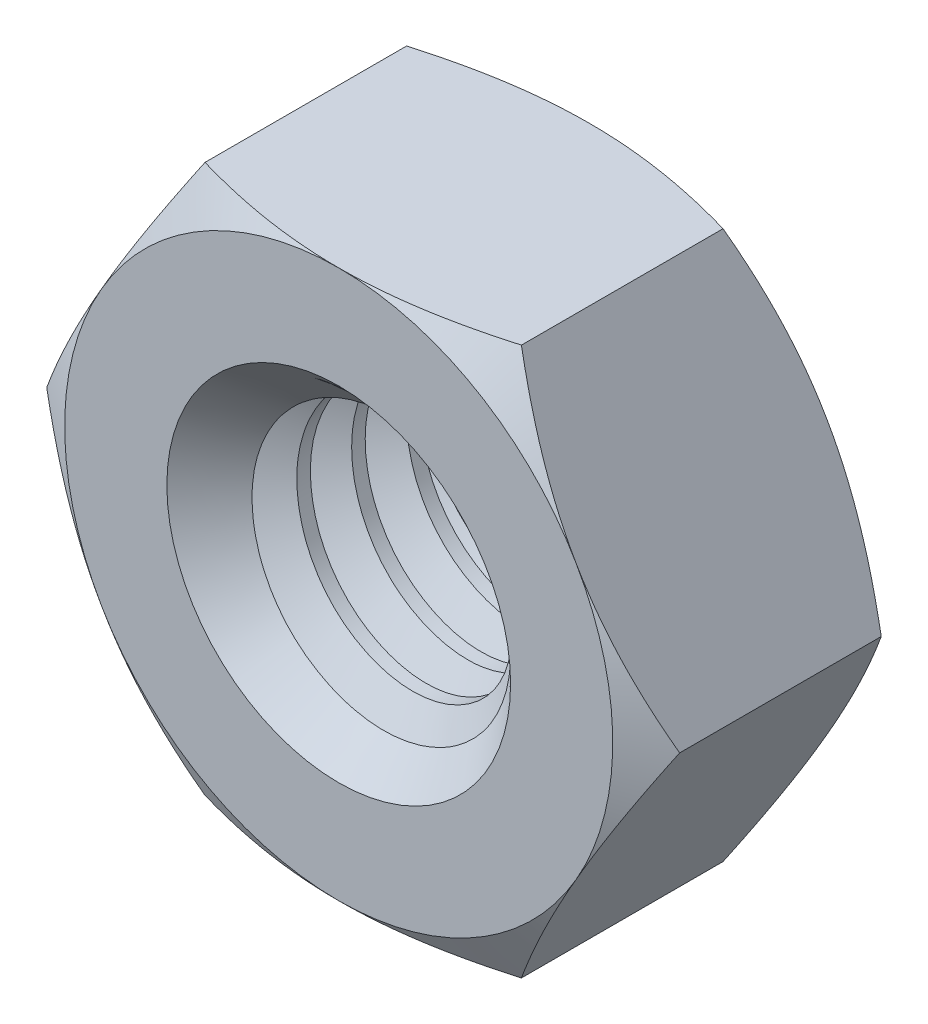
from build123d import *

# Parameters (mm, degrees)
Y_KSEKLIK_EKSTR_ZYON1_DEPTH = 3.2
IZIM2_OUTSIDE_W             = 23.4
IZIM2_OUTSIDE_H             = 22.318
IZIM2_OUTSIDE_R             = 3.5
KES_EKSTR_ZYON1_DEPTH       = 3.2
KES_EKSTR_ZYON1_DRAFT       = -60
IZIM3_OUTSIDE_W             = 23.4
IZIM3_OUTSIDE_H             = 22.318
IZIM3_OUTSIDE_R             = 3.5
KES_EKSTR_ZYON2_DEPTH       = 3.2
KES_EKSTR_ZYON2_DRAFT       = -60
IZIM5_R                     = 1.545
KES_EKSTR_ZYON3_DEPTH       = 3.2
PAH1_SIZE                   = 0.65
KES_S_P_R1_PITCH            = 0.7
KES_S_P_R1_HEIGHT           = 4
KES_S_P_R1_RADIUS           = 1.545


with BuildPart() as part:
    # Çizim1 → Yükseklik-Ekstrüzyon1 (new body)
    with BuildSketch(Plane.XY):
        Polygon((4.041451884, 0), (2.020725942, 3.5), (-2.020725942, 3.5), (-4.041451884, 0), (-2.020725942, -3.5), (2.020725942, -3.5), align=None)
    extrude(amount=Y_KSEKLIK_EKSTR_ZYON1_DEPTH)


with BuildPart() as kes_ekstr_zyon1_tool:
    # Çizim2 outside → Kes-Ekstrüzyon1 (with draft: the straight prism first)
    with BuildSketch(Plane.XY.offset(3.2)):
        Rectangle(IZIM2_OUTSIDE_W, IZIM2_OUTSIDE_H)
        Circle(IZIM2_OUTSIDE_R, mode=Mode.SUBTRACT)
    extrude(amount=-KES_EKSTR_ZYON1_DEPTH)
    # Kes-Ekstrüzyon1: the draft: its side faces are tilted about the plane it starts from
    kes_ekstr_zyon1_sides = [kes_ekstr_zyon1_tool.faces().sort_by_distance(p)[0] for p in [
        (0, -11.159, 1.6),
        (11.7, 0, 1.6),
        (0, 11.159, 1.6),
        (-11.7, 0, 1.6),
        (-3.5, 0, 1.6),
    ]]
    draft(kes_ekstr_zyon1_sides, Plane.XY.offset(3.2), KES_EKSTR_ZYON1_DRAFT)


with BuildPart() as part_1:
    add(part.part)

    # Kes-Ekstrüzyon1: cut by kes_ekstr_zyon1_tool
    add(kes_ekstr_zyon1_tool.part, mode=Mode.SUBTRACT)


with BuildPart() as kes_ekstr_zyon2_tool:
    # Çizim3 outside → Kes-Ekstrüzyon2 (with draft: the straight prism first)
    with BuildSketch(Plane(origin=(0, 0, 0), x_dir=(-1, 0, 0), z_dir=(0, 0, -1))):
        Rectangle(IZIM3_OUTSIDE_W, IZIM3_OUTSIDE_H)
        Circle(IZIM3_OUTSIDE_R, mode=Mode.SUBTRACT)
    extrude(amount=-KES_EKSTR_ZYON2_DEPTH)
    # Kes-Ekstrüzyon2: the draft: its side faces are tilted about the plane it starts from
    kes_ekstr_zyon2_sides = [kes_ekstr_zyon2_tool.faces().sort_by_distance(p)[0] for p in [
        (0, -11.159, 1.6),
        (-11.7, 0, 1.6),
        (0, 11.159, 1.6),
        (11.7, 0, 1.6),
        (3.5, 0, 1.6),
    ]]
    draft(kes_ekstr_zyon2_sides, Plane(origin=(0, 0, 0), x_dir=(-1, 0, 0), z_dir=(0, 0, -1)), KES_EKSTR_ZYON2_DRAFT)


with BuildPart() as part_2:
    add(part_1.part)

    # Kes-Ekstrüzyon2: cut by kes_ekstr_zyon2_tool
    add(kes_ekstr_zyon2_tool.part, mode=Mode.SUBTRACT)

    # Çizim5 → Kes-Ekstrüzyon3 (cut)
    with BuildSketch(Plane(origin=(0, 0, 0), x_dir=(-1, 0, 0), z_dir=(0, 0, -1))):
        Circle(IZIM5_R)
    extrude(amount=-KES_EKSTR_ZYON3_DEPTH, mode=Mode.SUBTRACT)

    # Pah1
    pah1_edges = [part_2.edges().sort_by_distance(p)[0] for p in [
        (1.545, 0, 3.2),
        (1.545, 0, 0),
    ]]
    chamfer(pah1_edges, length=PAH1_SIZE)

    # Kes-Süpür1: sweep along a helix
    with BuildLine() as kes_s_p_r1_path:
        Helix(KES_S_P_R1_PITCH, KES_S_P_R1_HEIGHT, KES_S_P_R1_RADIUS, center=(0, 0, 0), direction=(0, 0, 1))
    # Çizim7 → Kes-Süpür1 (sweep, cut)
    with BuildSketch(Plane(origin=(-0.343794843, -1.506263624, 4), x_dir=(0.07011904852635167, -0.016004215256580363, -0.9974102386319182), z_dir=(0.9724030815382076, -0.22194465783789016, 0.07192229051010418))):
        Polygon((0.347294283, 0.146531344), (-0.347294283, 0.146531344), (0, -0.455), align=None)
    sweep(path=kes_s_p_r1_path.line, is_frenet=True, mode=Mode.SUBTRACT)


solid = part_2.part
